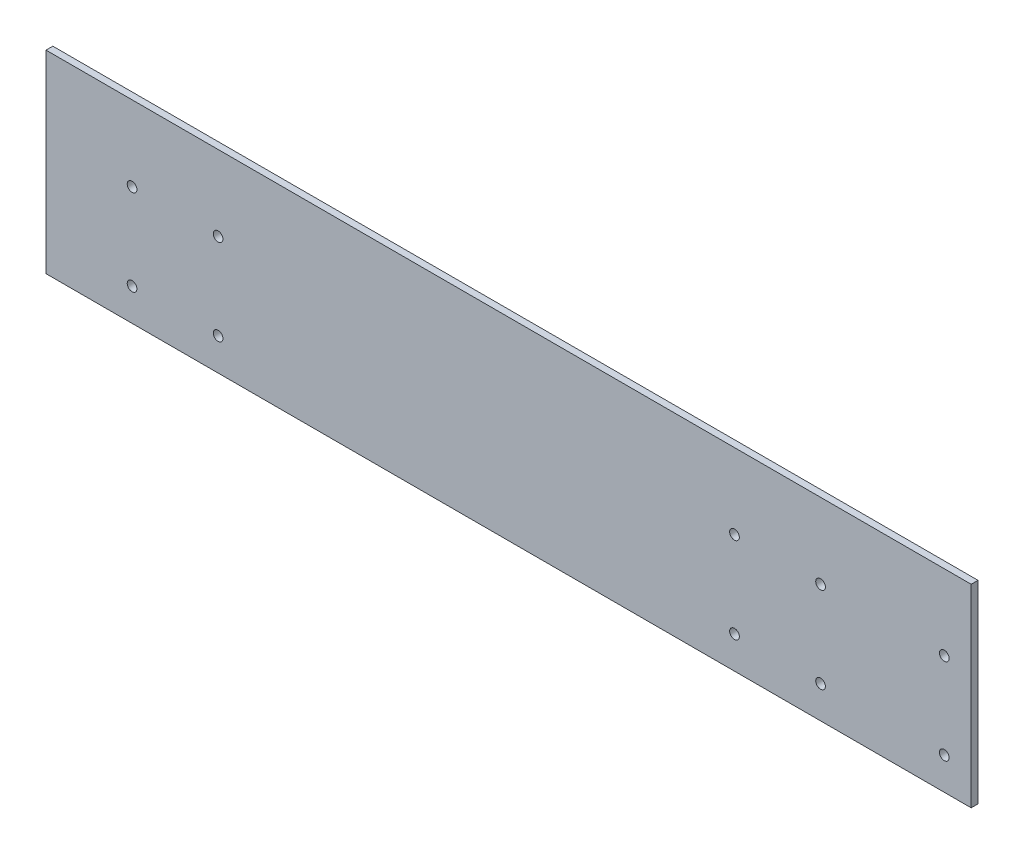
from build123d import *

# Parameters (mm, degrees)
SKETCH3_W                = 430
SKETCH3_H                = 90
BOSS_EXTRUDE1_DEPTH      = 3.175
M4_CLEARANCE_HOLE1_D     = 4.5
M4_CLEARANCE_HOLE1_DEPTH = 10.1
M4_CLEARANCE_HOLE1_TIP   = 1.351936393


with BuildPart() as part:
    # Sketch3 → Boss-Extrude1 (new body)
    with BuildSketch(Plane.XY):
        Rectangle(SKETCH3_W, SKETCH3_H)
    extrude(amount=BOSS_EXTRUDE1_DEPTH)

    # M4 Clearance Hole1
    with Locations(Plane.XY.offset(3.175)):
        with Locations((-135, 10), (-175, -30), (-175, 10), (-135, -30), (145, 10), (105, -30), (105, 10), (145, -30), (202.5, 10), (202.5, -30)):
            Hole(M4_CLEARANCE_HOLE1_D / 2, depth=M4_CLEARANCE_HOLE1_DEPTH)
            with Locations((0, 0, -(M4_CLEARANCE_HOLE1_DEPTH + M4_CLEARANCE_HOLE1_TIP / 2))):  # 118° drill point
                Cone(0, M4_CLEARANCE_HOLE1_D / 2, M4_CLEARANCE_HOLE1_TIP, mode=Mode.SUBTRACT)


solid = part.part
